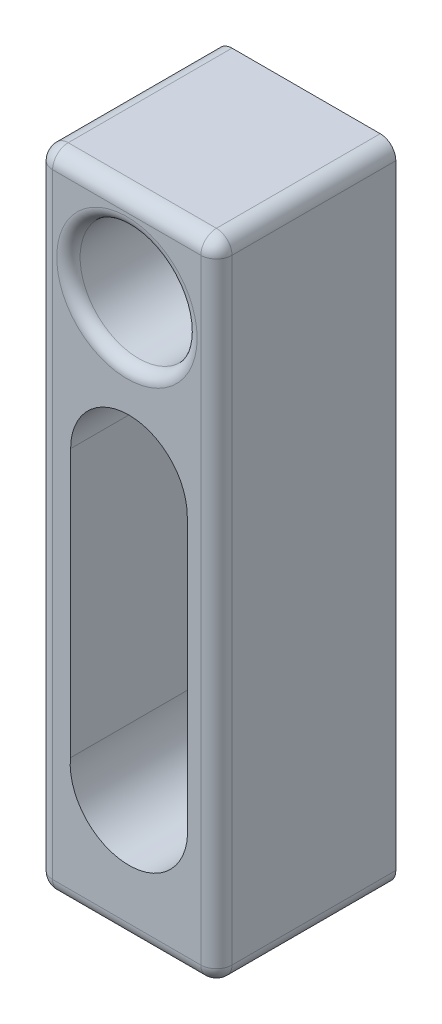
from build123d import *

# Parameters (mm, degrees)
SKETCH1_W           = 2.3
SKETCH1_H           = 8.28
BOSS_EXTRUDE1_DEPTH = 2.3
SKETCH4_R           = 0.75
CUT_EXTRUDE3_DEPTH  = 2.627407371
FILLET7_R           = 0.2
FILLET8_R           = 0.2
FILLET9_R           = 0.2
FILLET10_R          = 0.2
FILLET12_R          = 0.15
FILLET13_R          = 0.15
SKETCH9_R           = 0.747027578
SKETCH9_R_2         = 0.752905599
SKETCH9_W           = 1.5
SKETCH9_H           = 3.5
CUT_EXTRUDE4_DEPTH  = 2.3


with BuildPart() as part:
    # Sketch1 → Boss-Extrude1 (new body)
    with BuildSketch(Plane.XY):
        with Locations((1.15, -4.14)):
            Rectangle(SKETCH1_W, SKETCH1_H)
    extrude(amount=BOSS_EXTRUDE1_DEPTH)

    # Sketch4 → Cut-Extrude3 (cut)
    with BuildSketch(Plane(origin=(-0.047615046, -0.231066523, 2.3), x_dir=(1, 0, 0), z_dir=(0, 0, 1))):
        with Locations((1.200582347, -0.913587841)):
            Circle(SKETCH4_R)
    extrude(amount=-CUT_EXTRUDE3_DEPTH, mode=Mode.SUBTRACT)

    # Fillet7
    fillet7_edges = [part.edges().sort_by_distance(p)[0] for p in [
        (1.15, 0, 2.3),
    ]]
    fillet(fillet7_edges, radius=FILLET7_R)

    # Fillet8
    fillet8_edges = [part.edges().sort_by_distance(p)[0] for p in [
        (2.3, -4.24, 2.3),
        (2.3, 0, 1.05),
        (2.3, -0.058578644, 2.241421356),
    ]]
    fillet(fillet8_edges, radius=FILLET8_R)

    # Fillet9
    fillet9_edges = [part.edges().sort_by_distance(p)[0] for p in [
        (0, -4.24, 2.3),
        (0, 0, 1.05),
        (0, -0.058578644, 2.241421356),
    ]]
    fillet(fillet9_edges, radius=FILLET9_R)

    # Fillet10
    fillet10_edges = [part.edges().sort_by_distance(p)[0] for p in [
        (2.3, -8.28, 1.05),
        (2.241421356, -8.28, 2.241421356),
        (0, -8.28, 1.05),
        (1.15, -8.28, 2.3),
        (0.058578644, -8.28, 2.241421356),
    ]]
    fillet(fillet10_edges, radius=FILLET10_R)

    # Fillet12
    fillet12_edges = [part.edges().sort_by_distance(p)[0] for p in [
        (0.402967301, -1.144654364, 2.3),
    ]]
    fillet(fillet12_edges, radius=FILLET12_R)

    # Fillet13
    fillet13_edges = [part.edges().sort_by_distance(p)[0] for p in [
        (0.402967301, -1.144654364, 0),
    ]]
    fillet(fillet13_edges, radius=FILLET13_R)

    # Sketch9 → Cut-Extrude4 (cut)
    with BuildSketch(Plane(origin=(0, -0.220326659, 2.3), x_dir=(1, 0, 0), z_dir=(0, 0, 1))):
        with Locations((1.178039953, -2.960502764)):
            Circle(SKETCH9_R)
        with Locations((1.178039953, -6.460502764)):
            Circle(SKETCH9_R_2)
        with Locations((1.178039953, -4.710502764)):
            Rectangle(SKETCH9_W, SKETCH9_H)
    extrude(amount=-CUT_EXTRUDE4_DEPTH, mode=Mode.SUBTRACT)


solid = part.part
